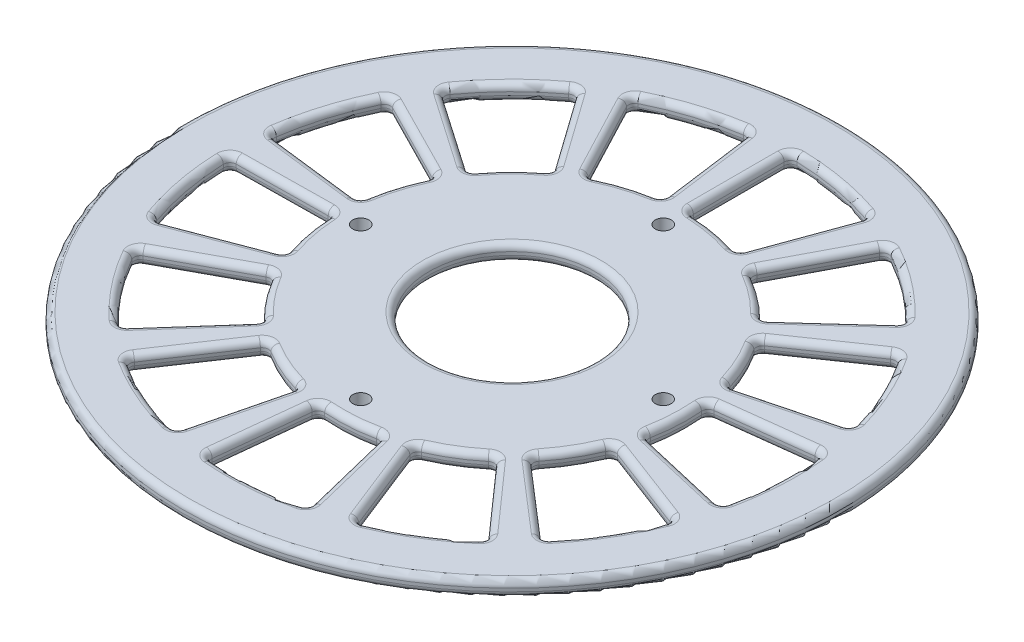
from build123d import *

# Parameters (mm, degrees)
SKETCH1_R               = 103.5
SKETCH1_R_2             = 26
BOSS_EXTRUDE1_DEPTH     = 5
FILLET1_R               = 2
CUT_EXTRUDE1_DEPTH      = 147.456478322
CUT_EXTRUDE1_DEPTH_BACK = 147.456478322
SKETCH2_R               = 2.5


with BuildPart() as part:
    # Sketch1 → Boss-Extrude1 (new body)
    with BuildSketch(Plane(origin=(0, 0, 0), x_dir=(1, 0, 0), z_dir=(0, 1, 0))):
        with Locations(Location((0, 0, 0), (0, 0, 270))):
            Circle(SKETCH1_R)
        with Locations(Location((0, 0, 0), (0, 0, 270))):
            Circle(SKETCH1_R_2, mode=Mode.SUBTRACT)
        with BuildLine():
            Line((0, 56.964901475), (0, 85.476604986))
            ThreePointArc((0, 85.476604986), (0.602424823, 86.907263445), (2.046783626, 87.476057735))
            ThreePointArc((2.046783626, 87.476057735), (15.194215546, 86.170678389), (27.995226335, 82.900647178))
            ThreePointArc((27.995226335, 82.900647178), (29.157940538, 81.872155577), (29.234720688, 80.321734956))
            Line((29.234720688, 80.321734956), (19.483143767, 53.529497559))
            ThreePointArc((19.483143767, 53.529497559), (18.480670092, 52.416032323), (16.986082788, 52.311308448))
            ThreePointArc((16.986082788, 52.311308448), (9.550649772, 54.164426416), (1.929824561, 54.966133002))
            ThreePointArc((1.929824561, 54.966133002), (0.561189575, 55.575720219), (0, 56.964901475))
        make_face(mode=Mode.SUBTRACT)
        with BuildLine():
            Line((26.472909708, 50.439915261), (39.722959005, 75.685774938))
            ThreePointArc((39.722959005, 75.685774938), (40.921239832, 76.672599316), (42.464487923, 76.505014642))
            ThreePointArc((42.464487923, 76.505014642), (53.499320708, 69.239242369), (63.314393568, 60.39484719))
            ThreePointArc((63.314393568, 60.39484719), (63.865961987, 58.943822871), (63.213431044, 57.535312075))
            Line((63.213431044, 57.535312075), (42.127864951, 38.343747791))
            ThreePointArc((42.127864951, 38.343747791), (40.722765498, 37.823696035), (39.350706552, 38.425537001))
            ThreePointArc((39.350706552, 38.425537001), (33.628144445, 43.521809489), (27.25281047, 47.773259482))
            ThreePointArc((27.25281047, 47.773259482), (26.32423368, 48.949058548), (26.472909708, 50.439915261))
        make_face(mode=Mode.SUBTRACT)
        with BuildLine():
            Line((46.881194836, 32.359752329), (70.345866815, 48.556245963))
            ThreePointArc((70.345866815, 48.556245963), (71.865491949, 48.873166688), (73.15408979, 48.007594681))
            ThreePointArc((73.15408979, 48.007594681), (79.548376233, 36.445930345), (84.128996257, 24.053315547))
            ThreePointArc((84.128996257, 24.053315547), (83.943061213, 22.512170696), (82.710706153, 21.568242574))
            Line((82.710706153, 21.568242574), (55.12159997, 14.373907497))
            ThreePointArc((55.12159997, 14.373907497), (53.635766091, 14.56640681), (52.700557673, 15.736938106))
            ThreePointArc((52.700557673, 15.736938106), (50.001836489, 22.908870503), (46.332505932, 29.636107944))
            ThreePointArc((46.332505932, 29.636107944), (46.056713089, 31.108757464), (46.881194836, 32.359752329))
        make_face(mode=Mode.SUBTRACT)
        with BuildLine():
            Line((56.549563206, 6.866360115), (84.853384298, 10.303066205))
            ThreePointArc((84.853384298, 10.303066205), (86.346225934, 9.877480558), (87.084971288, 8.512213333))
            ThreePointArc((87.084971288, 8.512213333), (87.373857424, -4.696705099), (85.670659767, -17.798540813))
            ThreePointArc((85.670659767, -17.798540813), (84.789816738, -19.076748484), (83.259955253, -19.339851375))
            Line((83.259955253, -19.339851375), (55.487640724, -12.888821781))
            ThreePointArc((55.487640724, -12.888821781), (54.261459054, -12.027870671), (53.977346142, -10.556803659))
            ThreePointArc((53.977346142, -10.556803659), (54.920710381, -2.952214634), (54.797982652, 4.709681231))
            ThreePointArc((54.797982652, 4.709681231), (55.238154574, 6.141814947), (56.549563206, 6.866360115))
        make_face(mode=Mode.SUBTRACT)
        with BuildLine():
            Line((53.263108142, -20.200032453), (79.922014032, -30.310421856))
            ThreePointArc((79.922014032, -30.310421856), (81.046080142, -31.381017332), (81.065735352, -32.933213507))
            ThreePointArc((81.065735352, -32.933213507), (75.183040849, -44.763382007), (67.586207568, -55.572965969))
            ThreePointArc((67.586207568, -55.572965969), (66.212247077, -56.295414487), (64.735351997, -55.817418445))
            Line((64.735351997, -55.817418445), (43.142131686, -37.198877316))
            ThreePointArc((43.142131686, -37.198877316), (42.456505669, -35.866707933), (42.888575107, -34.432108929))
            ThreePointArc((42.888575107, -34.432108929), (47.257911391, -28.136982976), (50.709901934, -21.295676695))
            ThreePointArc((50.709901934, -21.295676695), (51.765200538, -20.232143358), (53.263108142, -20.200032453))
        make_face(mode=Mode.SUBTRACT)
        with BuildLine():
            Line((37.774716892, -42.638841022), (56.681473516, -63.980157549))
            ThreePointArc((56.681473516, -63.980157549), (57.179254101, -65.450502333), (56.475316394, -66.834038021))
            ThreePointArc((56.475316394, -66.834038021), (45.768695669, -74.575307554), (34.018569717, -80.616294348))
            ThreePointArc((34.018569717, -80.616294348), (32.466249554, -80.617479464), (31.380659743, -79.507887622))
            Line((31.380659743, -79.507887622), (20.913280198, -52.987118353))
            ThreePointArc((20.913280198, -52.987118353), (20.925278491, -51.488914648), (21.974548378, -50.419432995))
            ThreePointArc((21.974548378, -50.419432995), (28.768894421, -46.875907605), (35.004793803, -42.42245173))
            ThreePointArc((35.004793803, -42.42245173), (36.433462896, -41.971161444), (37.774716892, -42.638841022))
        make_face(mode=Mode.SUBTRACT)
        with BuildLine():
            Line((13.632593237, -55.309604967), (20.455890503, -82.992810193))
            ThreePointArc((20.455890503, -82.992810193), (20.21335003, -84.526066014), (18.947083053, -85.423989861))
            ThreePointArc((18.947083053, -85.423989861), (5.869293884, -87.30292887), (-7.342312487, -87.191401224))
            ThreePointArc((-7.342312487, -87.191401224), (-8.71737448, -86.471051441), (-9.16296348, -84.984057918))
            Line((-9.16296348, -84.984057918), (-6.106551751, -56.636649139))
            ThreePointArc((-6.106551751, -56.636649139), (-5.399677812, -55.315631526), (-3.973582562, -54.856272582))
            ThreePointArc((-3.973582562, -54.856272582), (3.689270442, -54.876126718), (11.280509266, -53.83075432))
            ThreePointArc((11.280509266, -53.83075432), (12.755257976, -54.09509225), (13.632593237, -55.309604967))
        make_face(mode=Mode.SUBTRACT)
        with BuildLine():
            Line((-13.632593237, -55.309604967), (-20.455890503, -82.992810193))
            ThreePointArc((-20.455890503, -82.992810193), (-21.383188936, -84.23772662), (-22.921698679, -84.444335095))
            ThreePointArc((-22.921698679, -84.444335095), (-35.374692397, -80.030501297), (-47.021159386, -73.792008849))
            ThreePointArc((-47.021159386, -73.792008849), (-47.903953077, -72.515147623), (-47.607462195, -70.991404715))
            Line((-47.607462195, -70.991404715), (-31.727446286, -47.311406153))
            ThreePointArc((-31.727446286, -47.311406153), (-30.487633001, -46.470203847), (-29.011413624, -46.72620121))
            ThreePointArc((-29.011413624, -46.72620121), (-22.235520935, -50.304886529), (-15.028004, -52.907079827))
            ThreePointArc((-15.028004, -52.907079827), (-13.845022828, -53.826489338), (-13.632593237, -55.309604967))
        make_face(mode=Mode.SUBTRACT)
        with BuildLine():
            Line((-37.774716892, -42.638841022), (-56.681473516, -63.980157549))
            ThreePointArc((-56.681473516, -63.980157549), (-58.081097011, -64.651539233), (-59.53939548, -64.119500823))
            ThreePointArc((-59.53939548, -64.119500823), (-68.514762962, -54.424050348), (-75.928025335, -43.487756538))
            ThreePointArc((-75.928025335, -43.487756538), (-76.116313329, -41.946897386), (-75.145665053, -40.73547623))
            Line((-75.145665053, -40.73547623), (-50.079965234, -27.147690182))
            ThreePointArc((-50.079965234, -27.147690182), (-48.591238886, -26.979012493), (-47.40307945, -27.891720253))
            ThreePointArc((-47.40307945, -27.891720253), (-43.066422433, -34.209403076), (-37.893782656, -39.863030944))
            ThreePointArc((-37.893782656, -39.863030944), (-37.273575754, -41.226886398), (-37.774716892, -42.638841022))
        make_face(mode=Mode.SUBTRACT)
        with BuildLine():
            Line((-53.263108142, -20.200032453), (-79.922014032, -30.310421856))
            ThreePointArc((-79.922014032, -30.310421856), (-81.473325715, -30.254463342), (-82.517334304, -29.105661637))
            ThreePointArc((-82.517334304, -29.105661637), (-85.958927024, -16.349705346), (-87.440695712, -3.220983288))
            ThreePointArc((-87.440695712, -3.220983288), (-86.891343499, -1.769118473), (-85.468901652, -1.147541057))
            Line((-85.468901652, -1.147541057), (-56.959767675, -0.764765555))
            ThreePointArc((-56.959767675, -0.764765555), (-55.56317753, -1.30725451), (-54.935271043, -2.667582317))
            ThreePointArc((-54.935271043, -2.667582317), (-54.031325558, -10.276957646), (-52.078552375, -17.686842074))
            ThreePointArc((-52.078552375, -17.686842074), (-52.163201669, -19.182700622), (-53.263108142, -20.200032453))
        make_face(mode=Mode.SUBTRACT)
        with BuildLine():
            Line((-56.549563206, 6.866360115), (-84.853384298, 10.303066205))
            ThreePointArc((-84.853384298, 10.303066205), (-86.200997357, 11.073545494), (-86.591546281, 12.57593387))
            ThreePointArc((-86.591546281, 12.57593387), (-83.710936822, 25.470160116), (-78.921756476, 37.783678416))
            ThreePointArc((-78.921756476, 37.783678416), (-77.760614027, 38.813944161), (-76.212242893, 38.703281943))
            Line((-76.212242893, 38.703281943), (-50.790773783, 25.793357644))
            ThreePointArc((-50.790773783, 25.793357644), (-49.806261811, 24.663979728), (-49.882454082, 23.167666579))
            ThreePointArc((-49.882454082, 23.167666579), (-52.618303146, 16.00981493), (-54.33275336, 8.541189166))
            ThreePointArc((-54.33275336, 8.541189166), (-55.102866717, 7.256010689), (-56.549563206, 6.866360115))
        make_face(mode=Mode.SUBTRACT)
        with BuildLine():
            Line((-46.881194836, 32.359752329), (-70.345866815, 48.556245963))
            ThreePointArc((-70.345866815, 48.556245963), (-71.18105934, 49.864738508), (-70.828678546, 51.376534483))
            ThreePointArc((-70.828678546, 51.376534483), (-62.285779821, 61.455118844), (-52.322793942, 70.132554738))
            ThreePointArc((-52.322793942, 70.132554738), (-50.815864998, 70.505199948), (-49.496277745, 69.687649475))
            Line((-49.496277745, 69.687649475), (-32.986225711, 46.442533451))
            ThreePointArc((-32.986225711, 46.442533451), (-32.639331741, 44.984993443), (-33.40216804, 43.695482264))
            ThreePointArc((-33.40216804, 43.695482264), (-39.151061602, 38.628931845), (-44.13997533, 32.8125369))
            ThreePointArc((-44.13997533, 32.8125369), (-45.419129062, 32.032457397), (-46.881194836, 32.359752329))
        make_face(mode=Mode.SUBTRACT)
        with BuildLine():
            Line((-26.472909708, 50.439915261), (-39.722959005, 75.685774938))
            ThreePointArc((-39.722959005, 75.685774938), (-39.854398452, 77.232520865), (-38.839814134, 78.407390201))
            ThreePointArc((-38.839814134, 78.407390201), (-26.591701288, 83.361450459), (-13.737309873, 86.414907958))
            ThreePointArc((-13.737309873, 86.414907958), (-12.229813696, 86.044564106), (-11.441311861, 84.707416339))
            Line((-11.441311861, 84.707416339), (-7.624930857, 56.452284537))
            ThreePointArc((-7.624930857, 56.452284537), (-7.995124116, 55.000487288), (-9.269847839, 54.213189549))
            ThreePointArc((-9.269847839, 54.213189549), (-16.714783667, 52.398626003), (-23.835260897, 49.566927865))
            ThreePointArc((-23.835260897, 49.566927865), (-25.330416298, 49.470654147), (-26.472909708, 50.439915261))
        make_face(mode=Mode.SUBTRACT)
    extrude(amount=BOSS_EXTRUDE1_DEPTH)

    # Fillet1
    fillet1_edges = [part.edges().sort_by_distance(p)[0] for p in [
        (-16.714783667, 5, -52.398626003),
        (-50.815864998, 5, -70.505199948),
        (-62.285779821, 5, -61.455118844),
        (-58.613530825, 5, -40.457999146),
        (-77.760614027, 5, -38.813944161),
        (-83.710936822, 5, -25.470160116),
        (-86.200997357, 5, -11.073545494),
        (-70.701473752, 5, -8.58471316),
        (-71.214334664, 5, 0.956153306),
        (-86.891343499, 5, 1.769118473),
        (-85.958927024, 5, 16.349705346),
        (-81.473325715, 5, 30.254463342),
        (-76.116313329, 5, 41.946897386),
        (-47.228095204, 5, 53.309499286),
        (-22.235520935, 5, 50.304886529),
        (-30.487633001, 5, 46.470203847),
        (-39.66745424, 5, 59.151405434),
        (-17.04424187, 5, 69.15120758),
        (-8.71737448, 5, 86.471051441),
        (5.869293884, 5, 87.30292887),
        (20.21335003, 5, 84.526066014),
        (17.04424187, 5, 69.15120758),
        (36.433462896, 5, 41.971161444),
        (28.768894421, 5, 46.875907605),
        (20.925278491, 5, 51.488914648),
        (26.146969971, 5, 66.247502987),
        (32.466249554, 5, 80.617479464),
        (57.179254101, 5, 65.450502333),
        (47.228095204, 5, 53.309499286),
        (51.765200538, 5, 20.232143358),
        (54.920710381, 5, 2.952214634),
        (70.701473752, 5, -8.58471316),
        (46.056713089, 5, -31.108757464),
        (53.635766091, 5, -14.56640681),
        (71.865491949, 5, -48.873166688),
        (58.613530825, 5, -40.457999146),
        (26.32423368, 5, -48.949058548),
        (33.628144445, 5, -43.521809489),
        (40.722765498, 5, -37.823696035),
        (52.670647998, 5, -47.939529933),
        (40.921239832, 5, -76.672599316),
        (33.097934357, 5, -63.062845099),
        (9.550649772, 5, -54.164426416),
        (18.480670092, 5, -52.416032323),
        (0.602424823, 5, -86.907263445),
        (0, 5, -71.22075323),
        (0, 5, -26),
        (0, 5, -103.5),
        (-12.229813696, 0, -86.044564106),
        (-9.533121359, 0, -70.579850438),
        (-7.995124116, 0, -55.000487288),
        (-25.330416298, 0, -49.470654147),
        (-33.097934357, 0, -63.062845099),
        (-39.854398452, 0, -77.232520865),
        (-83.710936822, 0, -25.470160116),
        (-63.501508338, 0, -32.248319794),
        (-52.618303146, 0, -16.00981493),
        (-62.612815143, 0, 33.941583206),
        (-43.066422433, 0, 34.209403076),
        (-47.228095204, 0, 53.309499286),
        (-8.71737448, 0, 86.471051441),
        (-7.634757615, 0, 70.810353529),
        (20.21335003, 0, 84.526066014),
        (51.765200538, 0, 20.232143358),
        (83.943061213, 0, -22.512170696),
        (53.635766091, 0, -14.56640681),
        (50.001836489, 0, -22.908870503),
        (58.613530825, 0, -40.457999146),
        (29.157940538, 0, -81.872155577),
        (9.550649772, 0, -54.164426416),
        (0.561189575, 0, -55.575720219),
        (0, 0, -103.5),
        (0, 0, -26),
        (53.499320708, 0, -69.239242369),
        (52.670647998, 0, -47.939529933),
        (33.628144445, 0, -43.521809489),
        (26.32423368, 0, -48.949058548),
        (87.373857424, 0, 4.696705099),
        (84.789816738, 0, 19.076748484),
        (54.920710381, 0, 2.952214634),
        (32.466249554, 0, 80.617479464),
        (28.768894421, 0, 46.875907605),
        (47.228095204, 0, 53.309499286),
        (57.179254101, 0, 65.450502333),
        (-35.374692397, 0, 80.030501297),
        (-47.903953077, 0, 72.515147623),
        (-30.487633001, 0, 46.470203847),
        (-21.383188936, 0, 84.23772662),
        (-55.56317753, 0, 1.30725451),
        (-81.473325715, 0, 30.254463342),
        (-50.815864998, 0, -70.505199948),
        (-58.613530825, 0, -40.457999146),
        (-71.18105934, 0, -49.864738508),
    ]]
    fillet(fillet1_edges, radius=FILLET1_R)

    # Sketch2 → Cut-Extrude1 (cut, two sides: drawn at the far end of the back side and taken through both)
    with BuildSketch(Plane.XZ.offset(-CUT_EXTRUDE1_DEPTH_BACK)):
        with Locations(Location((0, 47.5, 0), (0, 0, 270))):
            Circle(SKETCH2_R)
        with Locations(Location((47.5, 0, 0), (0, 0, 270))):
            Circle(SKETCH2_R)
        with Locations(Location((0, -47.5, 0), (0, 0, 270))):
            Circle(SKETCH2_R)
        with Locations(Location((-47.5, 0, 0), (0, 0, 270))):
            Circle(SKETCH2_R)
    extrude(amount=CUT_EXTRUDE1_DEPTH + CUT_EXTRUDE1_DEPTH_BACK, mode=Mode.SUBTRACT)


solid = part.part
